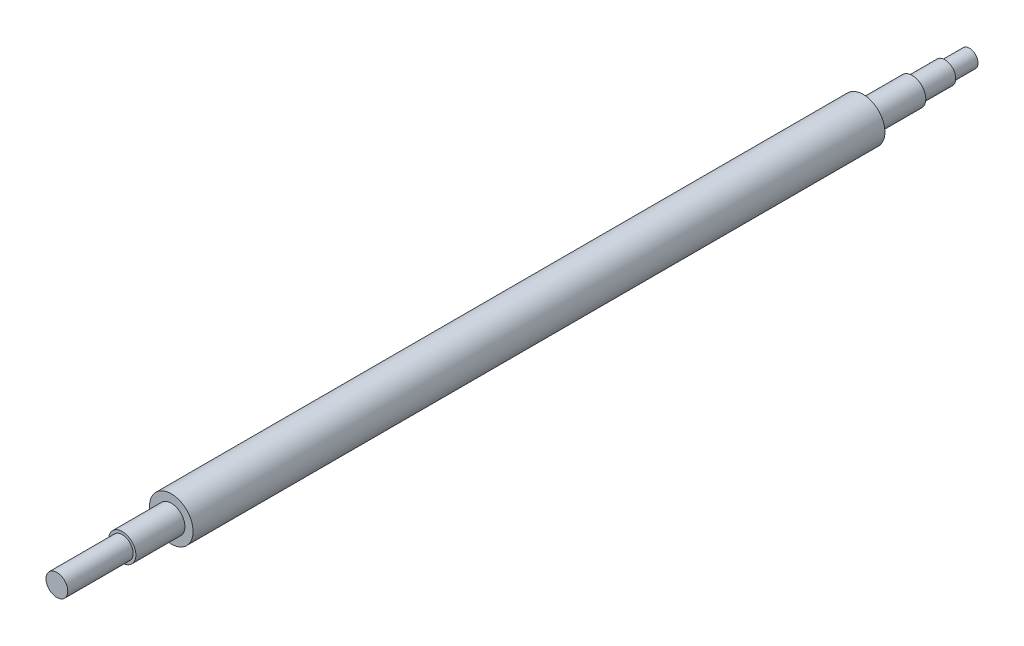
from build123d import *

# Parameters (mm, degrees)
SKETCH_1_R      = 8
EXTRUDE_1_DEPTH = 254
SKETCH_2_R      = 5
EXTRUDE_2_DEPTH = 18
SKETCH_4_R      = 5
EXTRUDE_3_DEPTH = 18
SKETCH_5_R      = 4
EXTRUDE_4_DEPTH = 24
SKETCH_9_R      = 4
EXTRUDE_5_DEPTH = 12
SKETCH_10_R     = 3.175
EXTRUDE_6_DEPTH = 9


with BuildPart() as part:
    # 草图1 → 凸台-拉伸1 (new body)
    with BuildSketch(Plane.XY):
        Circle(SKETCH_1_R)
    extrude(amount=EXTRUDE_1_DEPTH)


with BuildPart() as body_2:
    # 草图2 → 凸台-拉伸2 (new body)
    with BuildSketch(Plane.XY.offset(254)):
        Circle(SKETCH_2_R)
    extrude(amount=EXTRUDE_2_DEPTH)


with BuildPart() as body_3:
    # 草图4 → 凸台-拉伸3 (new body)
    with BuildSketch(Plane(origin=(0, 0, 0), x_dir=(-1, 0, 0), z_dir=(0, 0, -1))):
        Circle(SKETCH_4_R)
    extrude(amount=EXTRUDE_3_DEPTH)

    # 草图9 → 凸台-拉伸5 (add)
    with BuildSketch(Plane(origin=(0, 0, -18), x_dir=(-1, 0, 0), z_dir=(0, 0, -1))):
        with Locations(Location((0, 0, 0), (0, 0, 180))):
            Circle(SKETCH_9_R)
    extrude(amount=EXTRUDE_5_DEPTH)

    # 草图10 → 凸台-拉伸6 (add)
    with BuildSketch(Plane(origin=(0, 0, -30), x_dir=(-1, 0, 0), z_dir=(0, 0, -1))):
        Circle(SKETCH_10_R)
    extrude(amount=EXTRUDE_6_DEPTH)


with BuildPart() as body_4:
    # 草图5 → 凸台-拉伸4 (new body)
    with BuildSketch(Plane.XY.offset(272)):
        Circle(SKETCH_5_R)
    extrude(amount=EXTRUDE_4_DEPTH)


solid = Compound([part.part, body_2.part, body_3.part, body_4.part])
